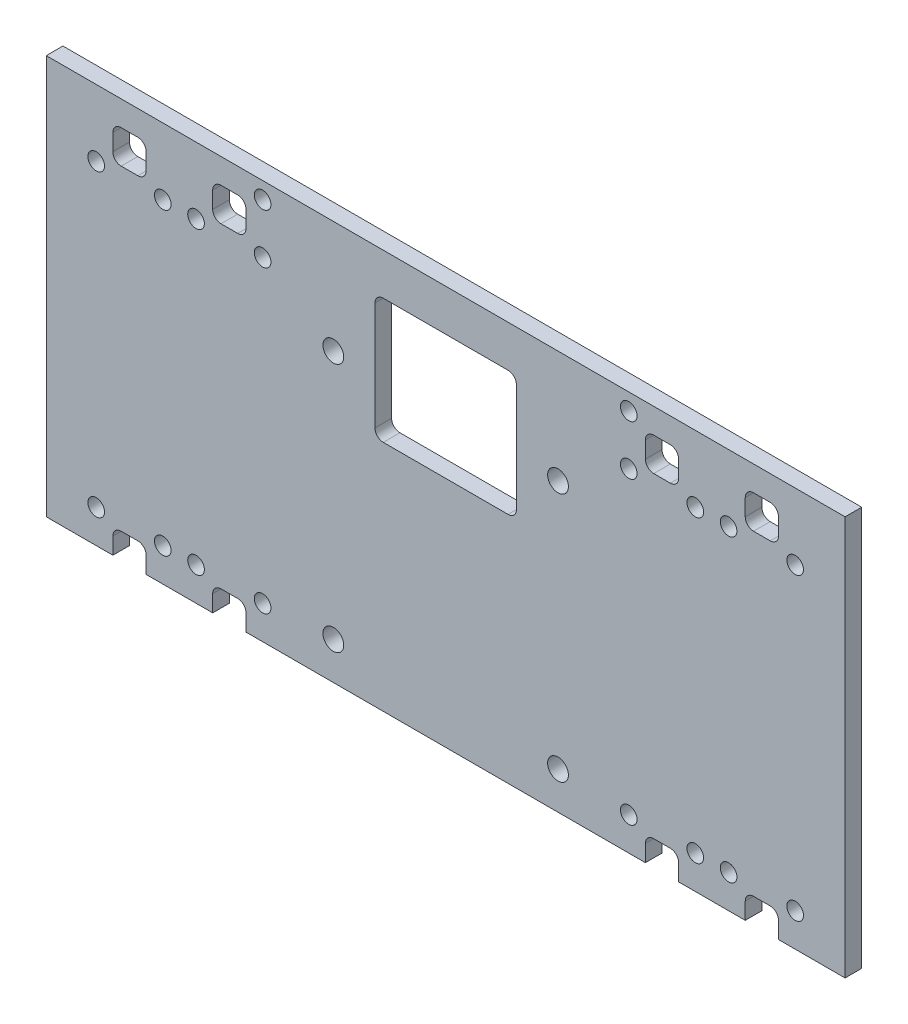
from build123d import *

# Parameters (mm, degrees)
SKETCH_1_R      = 1.25
SKETCH_1_R_2    = 1
EXTRUDE_3_DEPTH = 2


with BuildPart() as part:
    # 草圖1 → 填料-伸長3 (new body)
    with BuildSketch(Plane.XY):
        with BuildLine():
            Line((-53.694067148, 36.989902751), (-54.694067148, 36.989902751))
            Line((-54.694067148, 36.989902751), (-54.694067148, 35.989902751))
            Line((-54.694067148, 35.989902751), (-54.694067148, -10.010097249))
            Line((-54.694067148, -10.010097249), (-54.694067148, -11.010097249))
            Line((-54.694067148, -11.010097249), (-53.694067148, -11.010097249))
            Line((-53.694067148, -11.010097249), (-46.694067148, -11.010097249))
            Line((-46.694067148, -11.010097249), (-46.694067148, -9.010097249))
            ThreePointArc((-46.694067148, -9.010097249), (-46.401173929, -8.302990468), (-45.694067148, -8.010097249))
            Line((-45.694067148, -8.010097249), (-43.694067148, -8.010097249))
            ThreePointArc((-43.694067148, -8.010097249), (-42.986960367, -8.302990468), (-42.694067148, -9.010097249))
            Line((-42.694067148, -9.010097249), (-42.694067148, -11.010097249))
            Line((-42.694067148, -11.010097249), (-34.694067148, -11.010097249))
            Line((-34.694067148, -11.010097249), (-34.694067148, -9.010097249))
            ThreePointArc((-34.694067148, -9.010097249), (-34.401173929, -8.302990468), (-33.694067148, -8.010097249))
            Line((-33.694067148, -8.010097249), (-31.694067148, -8.010097249))
            ThreePointArc((-31.694067148, -8.010097249), (-30.986960367, -8.302990468), (-30.694067148, -9.010097249))
            Line((-30.694067148, -9.010097249), (-30.694067148, -11.010097249))
            Line((-30.694067148, -11.010097249), (17.305932852, -11.010097249))
            Line((17.305932852, -11.010097249), (17.305932852, -9.010097249))
            ThreePointArc((17.305932852, -9.010097249), (17.598826071, -8.302990468), (18.305932852, -8.010097249))
            Line((18.305932852, -8.010097249), (20.305932852, -8.010097249))
            ThreePointArc((20.305932852, -8.010097249), (21.013039633, -8.302990468), (21.305932852, -9.010097249))
            Line((21.305932852, -9.010097249), (21.305932852, -11.010097249))
            Line((21.305932852, -11.010097249), (29.305932852, -11.010097249))
            Line((29.305932852, -11.010097249), (29.305932852, -9.010097249))
            ThreePointArc((29.305932852, -9.010097249), (29.598826071, -8.302990468), (30.305932852, -8.010097249))
            Line((30.305932852, -8.010097249), (32.305932852, -8.010097249))
            ThreePointArc((32.305932852, -8.010097249), (33.013039633, -8.302990468), (33.305932852, -9.010097249))
            Line((33.305932852, -9.010097249), (33.305932852, -11.010097249))
            Line((33.305932852, -11.010097249), (40.305932852, -11.010097249))
            Line((40.305932852, -11.010097249), (41.305932852, -11.010097249))
            Line((41.305932852, -11.010097249), (41.305932852, -10.010097249))
            Line((41.305932852, -10.010097249), (41.305932852, 35.989902751))
            Line((41.305932852, 35.989902751), (41.305932852, 36.989902751))
            Line((41.305932852, 36.989902751), (40.305932852, 36.989902751))
            Line((40.305932852, 36.989902751), (-53.694067148, 36.989902751))
        make_face()
        with Locations((-20.194067148, 23.489902751)):
            Circle(SKETCH_1_R, mode=Mode.SUBTRACT)
        with Locations((6.805932852, 23.489902751)):
            Circle(SKETCH_1_R, mode=Mode.SUBTRACT)
        with Locations((6.805932852, -6.510097249)):
            Circle(SKETCH_1_R, mode=Mode.SUBTRACT)
        with Locations((-20.194067148, -6.510097249)):
            Circle(SKETCH_1_R, mode=Mode.SUBTRACT)
        with Locations((27.305932852, 28.989902751)):
            Circle(SKETCH_1_R_2, mode=Mode.SUBTRACT)
        with Locations((-48.694067148, 28.989902751)):
            Circle(SKETCH_1_R_2, mode=Mode.SUBTRACT)
        with Locations((-28.694067148, 34.989902751)):
            Circle(SKETCH_1_R_2, mode=Mode.SUBTRACT)
        with Locations((-36.694067148, 28.989902751)):
            Circle(SKETCH_1_R_2, mode=Mode.SUBTRACT)
        with Locations((-28.694067148, -7.010097249)):
            Circle(SKETCH_1_R_2, mode=Mode.SUBTRACT)
        with Locations((15.305932852, 34.989902751)):
            Circle(SKETCH_1_R_2, mode=Mode.SUBTRACT)
        with Locations((-28.694067148, 28.989902751)):
            Circle(SKETCH_1_R_2, mode=Mode.SUBTRACT)
        with Locations((-36.694067148, -7.010097249)):
            Circle(SKETCH_1_R_2, mode=Mode.SUBTRACT)
        with Locations((-40.694067148, -7.010097249)):
            Circle(SKETCH_1_R_2, mode=Mode.SUBTRACT)
        with Locations((-48.694067148, -7.010097249)):
            Circle(SKETCH_1_R_2, mode=Mode.SUBTRACT)
        with Locations((35.305932852, -7.010097249)):
            Circle(SKETCH_1_R_2, mode=Mode.SUBTRACT)
        with Locations((-40.694067148, 28.989902751)):
            Circle(SKETCH_1_R_2, mode=Mode.SUBTRACT)
        with Locations((27.305932852, -7.010097249)):
            Circle(SKETCH_1_R_2, mode=Mode.SUBTRACT)
        with Locations((23.305932852, -7.010097249)):
            Circle(SKETCH_1_R_2, mode=Mode.SUBTRACT)
        with Locations((15.305932852, 28.989902751)):
            Circle(SKETCH_1_R_2, mode=Mode.SUBTRACT)
        with Locations((15.305932852, -7.010097249)):
            Circle(SKETCH_1_R_2, mode=Mode.SUBTRACT)
        with Locations((23.305932852, 28.989902751)):
            Circle(SKETCH_1_R_2, mode=Mode.SUBTRACT)
        with Locations((35.305932852, 28.989902751)):
            Circle(SKETCH_1_R_2, mode=Mode.SUBTRACT)
        with BuildLine():
            Line((-14.194067148, 31.989902751), (0.805932852, 31.989902751))
            ThreePointArc((0.805932852, 31.989902751), (1.513039633, 31.697009532), (1.805932852, 30.989902751))
            Line((1.805932852, 30.989902751), (1.805932852, 17.989902751))
            ThreePointArc((1.805932852, 17.989902751), (1.513039633, 17.28279597), (0.805932852, 16.989902751))
            Line((0.805932852, 16.989902751), (-14.194067148, 16.989902751))
            ThreePointArc((-14.194067148, 16.989902751), (-14.901173929, 17.28279597), (-15.194067148, 17.989902751))
            Line((-15.194067148, 17.989902751), (-15.194067148, 30.989902751))
            ThreePointArc((-15.194067148, 30.989902751), (-14.901173929, 31.697009532), (-14.194067148, 31.989902751))
        make_face(mode=Mode.SUBTRACT)
        with BuildLine():
            Line((-46.694067148, 30.989902751), (-46.694067148, 32.989902751))
            ThreePointArc((-46.694067148, 32.989902751), (-46.401173929, 33.697009532), (-45.694067148, 33.989902751))
            Line((-45.694067148, 33.989902751), (-43.694067148, 33.989902751))
            ThreePointArc((-43.694067148, 33.989902751), (-42.986960367, 33.697009532), (-42.694067148, 32.989902751))
            Line((-42.694067148, 32.989902751), (-42.694067148, 30.989902751))
            ThreePointArc((-42.694067148, 30.989902751), (-42.986960367, 30.28279597), (-43.694067148, 29.989902751))
            Line((-43.694067148, 29.989902751), (-45.694067148, 29.989902751))
            ThreePointArc((-45.694067148, 29.989902751), (-46.401173929, 30.28279597), (-46.694067148, 30.989902751))
        make_face(mode=Mode.SUBTRACT)
        with BuildLine():
            Line((-30.694067148, 30.989902751), (-30.694067148, 32.989902751))
            ThreePointArc((-30.694067148, 32.989902751), (-30.986960367, 33.697009532), (-31.694067148, 33.989902751))
            Line((-31.694067148, 33.989902751), (-33.694067148, 33.989902751))
            ThreePointArc((-33.694067148, 33.989902751), (-34.401173929, 33.697009532), (-34.694067148, 32.989902751))
            Line((-34.694067148, 32.989902751), (-34.694067148, 30.989902751))
            ThreePointArc((-34.694067148, 30.989902751), (-34.401173929, 30.28279597), (-33.694067148, 29.989902751))
            Line((-33.694067148, 29.989902751), (-31.694067148, 29.989902751))
            ThreePointArc((-31.694067148, 29.989902751), (-30.986960367, 30.28279597), (-30.694067148, 30.989902751))
        make_face(mode=Mode.SUBTRACT)
        with BuildLine():
            Line((20.305932852, 33.989902751), (18.305932852, 33.989902751))
            ThreePointArc((18.305932852, 33.989902751), (17.598826071, 33.697009532), (17.305932852, 32.989902751))
            Line((17.305932852, 32.989902751), (17.305932852, 30.989902751))
            ThreePointArc((17.305932852, 30.989902751), (17.598826071, 30.28279597), (18.305932852, 29.989902751))
            Line((18.305932852, 29.989902751), (20.305932852, 29.989902751))
            ThreePointArc((20.305932852, 29.989902751), (21.013039633, 30.28279597), (21.305932852, 30.989902751))
            Line((21.305932852, 30.989902751), (21.305932852, 32.989902751))
            ThreePointArc((21.305932852, 32.989902751), (21.013039633, 33.697009532), (20.305932852, 33.989902751))
        make_face(mode=Mode.SUBTRACT)
        with BuildLine():
            Line((32.305932852, 29.989902751), (30.305932852, 29.989902751))
            ThreePointArc((30.305932852, 29.989902751), (29.598826071, 30.28279597), (29.305932852, 30.989902751))
            Line((29.305932852, 30.989902751), (29.305932852, 32.989902751))
            ThreePointArc((29.305932852, 32.989902751), (29.598826071, 33.697009532), (30.305932852, 33.989902751))
            Line((30.305932852, 33.989902751), (32.305932852, 33.989902751))
            ThreePointArc((32.305932852, 33.989902751), (33.013039633, 33.697009532), (33.305932852, 32.989902751))
            Line((33.305932852, 32.989902751), (33.305932852, 30.989902751))
            ThreePointArc((33.305932852, 30.989902751), (33.013039633, 30.28279597), (32.305932852, 29.989902751))
        make_face(mode=Mode.SUBTRACT)
    extrude(amount=EXTRUDE_3_DEPTH)


solid = part.part
